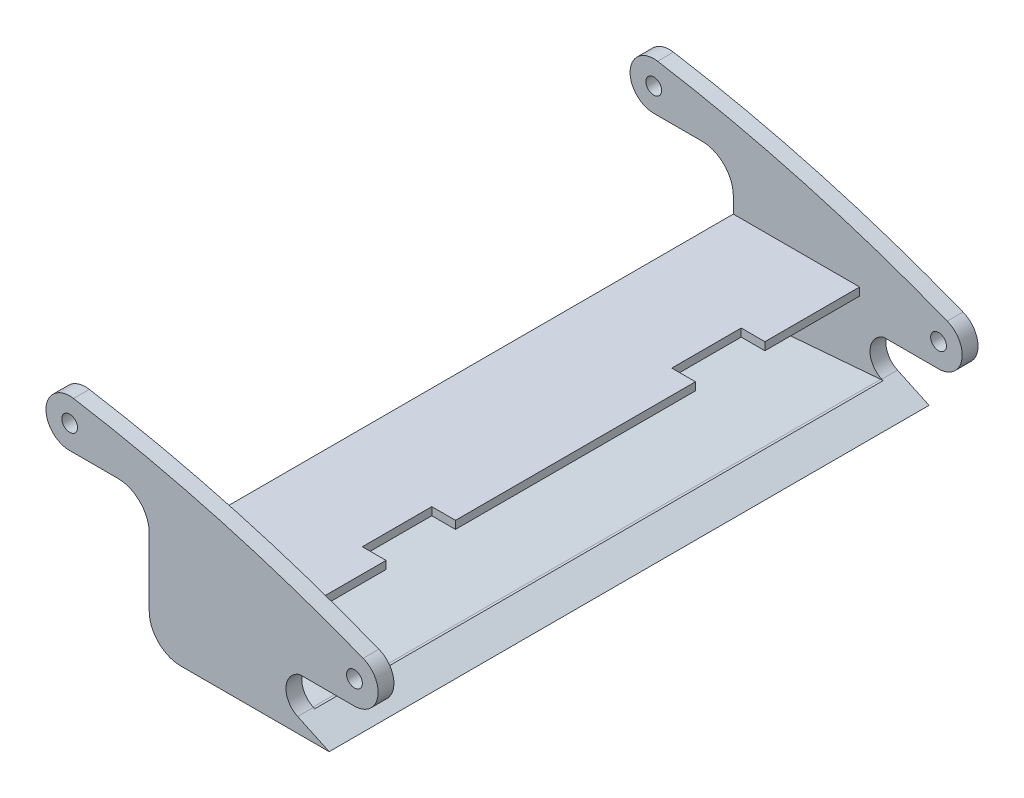
from build123d import *

# Parameters (mm, degrees)
SKETCH1_R           = 2.5
BOSS_EXTRUDE1_DEPTH = 190
SKETCH2_W           = 136.127535613
SKETCH2_H           = 180
CUT_EXTRUDE2_DEPTH  = 58
SKETCH3_W           = 45
SKETCH3_H           = 180
CUT_EXTRUDE3_DEPTH  = 3
BOSS_EXTRUDE2_START = 180
BOSS_EXTRUDE2_DEPTH = 180
SKETCH7_W           = 180
SKETCH7_H           = 22.5
CUT_EXTRUDE13_DEPTH = 30
SKETCH9_W           = 7.5
SKETCH9_H           = 22
CUT_EXTRUDE14_DEPTH = 3
BOSS_EXTRUDE3_DEPTH = 180


with BuildPart() as part:
    # Sketch1 → Boss-Extrude1 (new body)
    with BuildSketch(Plane.XY):
        with BuildLine():
            Line((0, 0), (47, 0))
            Line((47, 0), (37, 4.663076582))
            ThreePointArc((37, 4.663076582), (33.312668804, 10.778986497), (37.584760477, 16.501747909))
            Line((37.584760477, 16.501747909), (55, 16.501747909))
            ThreePointArc((55, 16.501747909), (62.367611495, 22.598786451), (57.756393324, 30.976867682))
            ThreePointArc((57.756393324, 30.976867682), (12.567155409, 46.120826206), (-33.970281413, 56.400596496))
            ThreePointArc((-33.970281413, 56.400596496), (-42.672566196, 49.617635726), (-35.197896825, 41.501747909))
            Line((-35.197896825, 41.501747909), (-20, 41.501747909))
            ThreePointArc((-20, 41.501747909), (-12.928932188, 38.572815721), (-10, 31.501747909))
            Line((-10, 31.501747909), (-10, 10))
            ThreePointArc((-10, 10), (-7.071067812, 2.928932188), (0, 0))
        make_face()
        with Locations((55, 24.001747909)):
            Circle(SKETCH1_R, mode=Mode.SUBTRACT)
        with Locations((-35.197896825, 49.001747909)):
            Circle(SKETCH1_R, mode=Mode.SUBTRACT)
    extrude(amount=BOSS_EXTRUDE1_DEPTH)

    # Sketch2 → Cut-Extrude2 (cut)
    with BuildSketch(Plane(origin=(0, 62.46968133, 0), x_dir=(1, 0, 0), z_dir=(0, 1, 0))):
        with Locations((11.703146866, -95)):
            Rectangle(SKETCH2_W, SKETCH2_H)
    extrude(amount=-CUT_EXTRUDE2_DEPTH, mode=Mode.SUBTRACT)

    # Sketch3 → Cut-Extrude3 (cut)
    with BuildSketch(Plane(origin=(0, 4.46968133, 0), x_dir=(1, 0, 0), z_dir=(0, 1, 0))):
        with Locations((14.168398989, -95)):
            Rectangle(SKETCH3_W, SKETCH3_H)
    extrude(amount=-CUT_EXTRUDE3_DEPTH, mode=Mode.SUBTRACT)



with BuildPart() as body_2:
    # Sketch4 → Boss-Extrude2 (new body)
    with BuildSketch(Plane(origin=(0, 0, 185), x_dir=(-1, 0, 0), z_dir=(0, 0, -1)).offset(BOSS_EXTRUDE2_START)):
        with BuildLine():
            Line((-30, 26.46968133), (-30, 1.46968133))
            Line((-30, 1.46968133), (5.218588256, 1.46968133))
            ThreePointArc((5.218588256, 1.46968133), (8.723126806, 5.110515495), (10, 10))
            Line((10, 10), (10, 26.46968133))
            Line((10, 26.46968133), (-30, 26.46968133))
        make_face()
        with BuildLine():
            Line((-27.5, 23.96968133), (7.5, 23.96968133))
            Line((7.5, 23.96968133), (7.5, 10))
            ThreePointArc((7.5, 10), (6.696815143, 6.62321648), (4.459288815, 3.96968133))
            Line((4.459288815, 3.96968133), (-27.5, 3.96968133))
            Line((-27.5, 3.96968133), (-27.5, 23.96968133))
        make_face(mode=Mode.SUBTRACT)
    extrude(amount=-BOSS_EXTRUDE2_DEPTH)

    # Sketch7 → Cut-Extrude13 (cut)
    with BuildSketch(Plane(origin=(30, 0, 0), x_dir=(0, 0, -1), z_dir=(1, 0, 0))):
        with Locations((-95, 12.71968133)):
            Rectangle(SKETCH7_W, SKETCH7_H)
    extrude(amount=-CUT_EXTRUDE13_DEPTH, mode=Mode.SUBTRACT)

    # Sketch9 → Cut-Extrude14 (cut)
    with BuildSketch(Plane(origin=(0, 26.46968133, 0), x_dir=(1, 0, 0), z_dir=(0, 1, 0))):
        with Locations((26.25, -46)):
            Rectangle(SKETCH9_W, SKETCH9_H)
    cut_extrude14 = extrude(amount=-CUT_EXTRUDE14_DEPTH, mode=Mode.SUBTRACT)

    # Mirror1: Cut-Extrude14 across plane
    add(cut_extrude14.mirror(Plane.XY.offset(95)), mode=Mode.SUBTRACT)


with BuildPart() as part_1:
    add(part.part)

    add(body_2.part)  # Boss-Extrude3 merges body 2
    # Sketch10 → Boss-Extrude3 (add)
    with BuildSketch(Plane(origin=(0, 0, 185), x_dir=(-1, 0, 0), z_dir=(0, 0, -1))):
        Polygon((-36.668398989, 1.46968133), (-36.668398989, 4.46968133), (0, 1.46968133), align=None)
    extrude(amount=BOSS_EXTRUDE3_DEPTH)


solid = part_1.part
